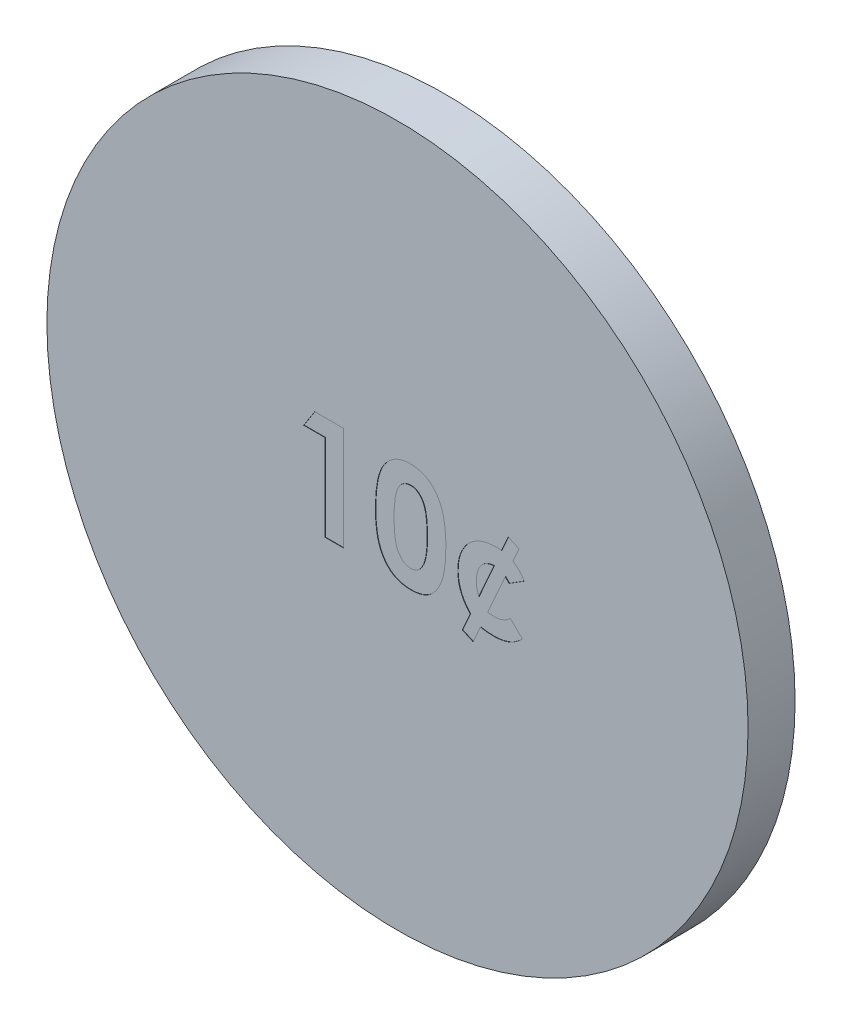
from build123d import *

# Parameters (mm, degrees)
SKETCH1_R           = 8.95
BOSS_EXTRUDE1_DEPTH = 1.2
CUT_EXTRUDE1_DEPTH  = 0.01


with BuildPart() as part:
    # Sketch1 → Boss-Extrude1 (new body)
    with BuildSketch(Plane.XY):
        Circle(SKETCH1_R)
    extrude(amount=BOSS_EXTRUDE1_DEPTH)

    # Sketch2 → Cut-Extrude1 (cut)
    # profile 1 of 3: a face of its own
    with BuildSketch(Plane.XY.offset(1.2)):
        Polygon((-2.111928597, 1.461526961), (-1.377858251, 1.461526961), (-1.377858251, -1.184306373), (-1.852751414, -1.184306373), (-1.852751414, 1.020554738), (-2.395486456, 1.020554738), align=None)
    # profile 2 of 3: a face of its own
    with BuildSketch(Plane.XY.offset(1.2)):
        with BuildLine():
            add(Edge.make_bspline(
                [(0.327199007, 1.529368841), (0.350185807, 1.529027595), (0.395383998, 1.528356616), (0.461952425, 1.521089357), (0.526076225, 1.510110556), (0.588006258, 1.494798957), (0.647296747, 1.474534601), (0.704379218, 1.450278514), (0.758574227, 1.420758415), (0.810572931, 1.387413947), (0.860355302, 1.349663282), (0.906724855, 1.306625575), (0.950528395, 1.259291125), (0.990817739, 1.20694432), (1.028485106, 1.15006131), (1.063406726, 1.088633075), (1.095315267, 1.022358966), (1.124568348, 0.951119384), (1.150726544, 0.87384648), (1.172759561, 0.789653899), (1.19165656, 0.698522416), (1.20760696, 0.600225189), (1.219662884, 0.494631559), (1.22778882, 0.381811676), (1.233365222, 0.261983041), (1.233820329, 0.179781582), (1.234054142, 0.137550265)],
                knots=[0, 0, 0, 0, 0.879237366, 1.728815576, 2.559023295, 3.367336655, 4.166867292, 4.954216142, 5.737608147, 6.525189134, 7.316157332, 8.124696809, 8.942788509, 9.781158001, 10.649253743, 11.551476218, 12.482711956, 13.461909668, 14.496590415, 15.601789533, 16.789733467, 18.056700938, 19.410929216, 20.8549011, 22.384193279, 24, 24, 24, 24], degree=3))
            add(Edge.make_bspline(
                [(1.234054142, 0.137550265), (1.233801453, 0.094790586), (1.233310484, 0.011709297), (1.228020633, -0.109215351), (1.218911259, -0.222854374), (1.207170442, -0.329196014), (1.191088733, -0.428184115), (1.172254817, -0.520074988), (1.149874016, -0.604835325), (1.122854176, -0.682274145), (1.093778166, -0.753638839), (1.061782341, -0.81978373), (1.027424385, -0.880887975), (0.991492366, -0.937873415), (0.952016357, -0.989060147), (0.910917769, -1.036188789), (0.866407094, -1.07746415), (0.820358405, -1.115013377), (0.771084751, -1.147463445), (0.719094279, -1.175843739), (0.663460089, -1.198863528), (0.605196297, -1.218884911), (0.543309786, -1.233258104), (0.478783924, -1.24466276), (0.410890226, -1.250965672), (0.364665462, -1.25174759), (0.340979389, -1.252148253)],
                knots=[0, 0, 0, 0, 1.643780988, 3.193836972, 4.651895693, 6.025988579, 7.305620092, 8.505800249, 9.631074763, 10.672816429, 11.65661981, 12.592235626, 13.49536222, 14.350718032, 15.179365177, 15.97804903, 16.751647189, 17.51006938, 18.259804725, 19.016521909, 19.783502495, 20.571750527, 21.382245291, 22.22305063, 23.089471752, 24, 24, 24, 24], degree=3))
            add(Edge.make_bspline(
                [(0.340979389, -1.252148253), (0.317293955, -1.251739861), (0.270894537, -1.250939828), (0.202817248, -1.244709624), (0.137949431, -1.233211903), (0.075573299, -1.218774564), (0.016122978, -1.198907827), (-0.040686592, -1.175199302), (-0.094418597, -1.146996087), (-0.14522181, -1.114470414), (-0.192922776, -1.07717242), (-0.238262768, -1.035501049), (-0.28114149, -0.989561926), (-0.320906651, -0.938840497), (-0.358209489, -0.884013785), (-0.392660995, -0.824455697), (-0.424240463, -0.760252948), (-0.453935707, -0.691316046), (-0.479737115, -0.616160858), (-0.50269917, -0.534116259), (-0.521509081, -0.444498338), (-0.536637271, -0.347335886), (-0.548715608, -0.242834747), (-0.557700503, -0.13094448), (-0.563019737, -0.01161297), (-0.563505558, 0.070409521), (-0.563755687, 0.112639574)],
                knots=[0, 0, 0, 0, 0.917216111, 1.796812873, 2.643793957, 3.46689424, 4.273913431, 5.068098542, 5.848489301, 6.620921603, 7.401012384, 8.190319798, 9.003608147, 9.831726257, 10.68377682, 11.569763213, 12.493818149, 13.453288342, 14.474581811, 15.568529029, 16.750744269, 18.018426408, 19.375425659, 20.823733699, 22.36466933, 24, 24, 24, 24], degree=3))
            add(Edge.make_bspline(
                [(-0.563755687, 0.112639574), (-0.563302601, 0.171314909), (-0.562428366, 0.284529722), (-0.551349415, 0.448092211), (-0.535088325, 0.599277399), (-0.511204635, 0.73783239), (-0.481672783, 0.864270351), (-0.443855709, 0.977758376), (-0.400803721, 1.079866827), (-0.364117896, 1.140356487), (-0.346449664, 1.169488866)],
                knots=[0, 0, 0, 0, 1.288568992, 2.486310467, 3.599230591, 4.627010532, 5.572937695, 6.447898582, 7.252493626, 8, 8, 8, 8], degree=3))
            add(Edge.make_bspline(
                [(-0.346449664, 1.169488866), (-0.325905886, 1.198108506), (-0.285738751, 1.254065542), (-0.215505392, 1.327526671), (-0.140048793, 1.390354225), (-0.057819117, 1.441126361), (0.029883139, 1.481165272), (0.123810943, 1.509444304), (0.223617436, 1.525920985), (0.292156219, 1.528202393), (0.327199007, 1.529368841)],
                knots=[0, 0, 0, 0, 1.058512271, 2.069600068, 3.047294572, 4.004278952, 4.967380941, 5.939006123, 6.946246673, 8, 8, 8, 8], degree=3))
        make_face()
        with BuildLine():
            add(Edge.make_bspline(
                [(0.33885933, 1.054475679), (0.318079072, 1.053490736), (0.277338736, 1.051559725), (0.218222567, 1.035168166), (0.16247971, 1.00985052), (0.120077608, 0.979384692), (0.088340057, 0.950179542), (0.066164802, 0.923749831), (0.044780263, 0.894256178), (0.025892362, 0.860367687), (0.008057253, 0.82330201), (-0.009373025, 0.782890893), (-0.023661275, 0.73814175), (-0.037699103, 0.689816665), (-0.049997549, 0.636579579), (-0.060300951, 0.577995336), (-0.069506136, 0.513682957), (-0.075926861, 0.443600319), (-0.081912905, 0.367820745), (-0.086203984, 0.286175427), (-0.087997976, 0.198686392), (-0.088568232, 0.138433991), (-0.088862525, 0.107339427)],
                knots=[0, 0, 0, 0, 1.076674018, 2.110852608, 3.161083442, 4.239746716, 4.804137807, 5.395870207, 6.026861976, 6.692161227, 7.405688833, 8.16177676, 8.973626916, 9.841385931, 10.773283133, 11.807421078, 12.927755683, 14.143907515, 15.458935494, 16.872852025, 18.386167141, 20, 20, 20, 20], degree=3))
            add(Edge.make_bspline(
                [(-0.088862525, 0.107339427), (-0.088378154, 0.067054916), (-0.087449338, -0.010193621), (-0.082584634, -0.121279706), (-0.072833739, -0.222376989), (-0.060705593, -0.314170643), (-0.043671118, -0.396065362), (-0.024071851, -0.468835945), (0.000131501, -0.531554744), (0.028103137, -0.585128814), (0.059082985, -0.630704164), (0.092712973, -0.669443417), (0.12784812, -0.702989783), (0.165585108, -0.730239082), (0.205833908, -0.751121689), (0.248258518, -0.76614229), (0.292885896, -0.775337025), (0.323446265, -0.77661204), (0.33885933, -0.777255091)],
                knots=[0, 0, 0, 0, 1.771748488, 3.397459088, 4.888034009, 6.237357457, 7.467047327, 8.564189669, 9.548206622, 10.417051504, 11.216568818, 11.965764335, 12.669334354, 13.348544111, 14.005342236, 14.656555988, 15.322436492, 16, 16, 16, 16], degree=3))
            add(Edge.make_bspline(
                [(0.33885933, -0.777255091), (0.353743468, -0.776815067), (0.382884759, -0.775953556), (0.425379289, -0.767110262), (0.465565135, -0.752732987), (0.503320965, -0.732395322), (0.538781826, -0.706532868), (0.571774407, -0.675031977), (0.602049884, -0.637578656), (0.619688515, -0.609782753), (0.628777366, -0.595460052)],
                knots=[0, 0, 0, 0, 0.992283464, 1.942767638, 2.88273346, 3.832339453, 4.79467288, 5.803907806, 6.868395428, 8, 8, 8, 8], degree=3))
            add(Edge.make_bspline(
                [(0.628777366, -0.595460052), (0.639477957, -0.575888539), (0.66191623, -0.534848664), (0.687881837, -0.465595406), (0.709738239, -0.387489176), (0.728549724, -0.300286901), (0.741415632, -0.203644644), (0.752495736, -0.098175223), (0.757839946, 0.016652465), (0.758709211, 0.096205501), (0.759160979, 0.137550265)],
                knots=[0, 0, 0, 0, 0.710965849, 1.490837728, 2.352621235, 3.297892224, 4.334225155, 5.461620853, 6.680770821, 8, 8, 8, 8], degree=3))
            add(Edge.make_bspline(
                [(0.759160979, 0.137550265), (0.758986471, 0.179253921), (0.758650572, 0.25952634), (0.752487801, 0.374766841), (0.743905672, 0.480019913), (0.731352494, 0.575050569), (0.715200549, 0.6600895), (0.695293216, 0.735131149), (0.671823951, 0.800323408), (0.6439922, 0.855601271), (0.613166806, 0.902579872), (0.580444709, 0.942883867), (0.545687548, 0.977294401), (0.508953446, 1.005940968), (0.469392182, 1.027829093), (0.427759425, 1.04328392), (0.383969827, 1.052633572), (0.354099122, 1.053853355), (0.33885933, 1.054475679)],
                knots=[0, 0, 0, 0, 1.793836731, 3.452829483, 4.963243077, 6.335886805, 7.574563692, 8.684454726, 9.672768357, 10.54971625, 11.340229787, 12.085688095, 12.778991901, 13.440269426, 14.083255152, 14.715733572, 15.344777694, 16, 16, 16, 16], degree=3))
        make_face(mode=Mode.SUBTRACT)
    # profile 3 of 3: a face of its own
    with BuildSketch(Plane.XY.offset(1.2)):
        with BuildLine():
            Line((2.827278301, 1.160478617), (3.103945969, 1.038575238))
            Line((3.103945969, 1.038575238), (2.950241709, 0.690885601))
            add(Edge.make_bspline(
                [(2.950241709, 0.690885601), (2.979931768, 0.669283056), (3.038248552, 0.626851651), (3.115079278, 0.553012195), (3.182056863, 0.47390359), (3.217705259, 0.415941065), (3.235389612, 0.387187184)],
                knots=[0, 0, 0, 0, 1.047918432, 2.058306149, 3.036770164, 4, 4, 4, 4], degree=3))
            Line((3.235389612, 0.387187184), (2.843178741, 0.142320397))
            add(Edge.make_bspline(
                [(2.843178741, 0.142320397), (2.829218663, 0.160296267), (2.800987963, 0.196647885), (2.768459404, 0.229212065), (2.752016215, 0.245673261)],
                knots=[0, 0, 0, 0, 0.988999762, 2, 2, 2, 2], degree=3))
            Line((2.752016215, 0.245673261), (2.304153801, -0.764004723))
            add(Edge.make_bspline(
                [(2.304153801, -0.764004723), (2.335914556, -0.767936102), (2.398401265, -0.775670769), (2.461353938, -0.776732846), (2.492309016, -0.777255091)],
                knots=[0, 0, 0, 0, 1.01656031, 2, 2, 2, 2], degree=3))
            add(Edge.make_bspline(
                [(2.492309016, -0.777255091), (2.510363823, -0.776774241), (2.546121161, -0.775821923), (2.59877202, -0.767350059), (2.650138339, -0.755031243), (2.699434739, -0.735976244), (2.747774327, -0.712665071), (2.794053354, -0.683351372), (2.839136349, -0.649337367), (2.866742975, -0.623126205), (2.880809784, -0.609770449)],
                knots=[0, 0, 0, 0, 0.996505377, 1.973567467, 2.939160258, 3.908787646, 4.886336879, 5.898955714, 6.929424149, 8, 8, 8, 8], degree=3))
            Line((2.880809784, -0.609770449), (3.188218305, -0.913998881))
            add(Edge.make_bspline(
                [(3.188218305, -0.913998881), (3.162974941, -0.939178952), (3.113536174, -0.98849376), (3.031344339, -1.050605526), (2.947790855, -1.104571628), (2.859600286, -1.146887566), (2.766703152, -1.178908763), (2.667929449, -1.201568347), (2.562845429, -1.215525271), (2.490586356, -1.217312798), (2.453617944, -1.218227313)],
                knots=[0, 0, 0, 0, 1.043298656, 2.043285471, 3.011024784, 3.953140877, 4.900813052, 5.883793724, 6.917329236, 8, 8, 8, 8], degree=3))
            add(Edge.make_bspline(
                [(2.453617944, -1.218227313), (2.425693604, -1.217801049), (2.369597296, -1.216944742), (2.285526183, -1.210559268), (2.201387402, -1.199241524), (2.145640699, -1.188953402), (2.11758863, -1.183776358)],
                knots=[0, 0, 0, 0, 0.990386989, 1.989556538, 2.988333023, 4, 4, 4, 4], degree=3))
            Line((2.11758863, -1.183776358), (1.932083489, -1.603017978))
            Line((1.932083489, -1.603017978), (1.655415821, -1.481114599))
            Line((1.655415821, -1.481114599), (1.856821403, -1.026361995))
            add(Edge.make_bspline(
                [(1.856821403, -1.026361995), (1.831515947, -0.998568352), (1.781401171, -0.943525987), (1.716904836, -0.853425402), (1.661673804, -0.759188932), (1.617258498, -0.660057853), (1.581836188, -0.556709087), (1.557186644, -0.44870333), (1.541830954, -0.336197233), (1.540181367, -0.259657639), (1.539342603, -0.220739666)],
                knots=[0, 0, 0, 0, 1.014667843, 2.009442197, 2.986811145, 3.960841764, 4.938839748, 5.933304939, 6.94915064, 8, 8, 8, 8], degree=3))
            add(Edge.make_bspline(
                [(1.539342603, -0.220739666), (1.539840936, -0.196528263), (1.540827836, -0.148579898), (1.545916182, -0.077751703), (1.555476779, -0.008871997), (1.56942923, 0.057566686), (1.586235836, 0.122312539), (1.607409774, 0.184625146), (1.632602506, 0.24488972), (1.660954106, 0.303133773), (1.69338423, 0.358508472), (1.728314809, 0.411287898), (1.766422139, 0.460524141), (1.807677771, 0.506400641), (1.851402201, 0.549504482), (1.899106833, 0.588696512), (1.949140442, 0.625351843), (2.002468144, 0.658167436), (2.057644485, 0.68765062), (2.114723602, 0.713502455), (2.173796293, 0.734297159), (2.23412822, 0.752673598), (2.296330862, 0.766419188), (2.360110342, 0.775777528), (2.425411997, 0.781813987), (2.469505152, 0.782673813), (2.491779002, 0.783108157)],
                knots=[0, 0, 0, 0, 1.122951297, 2.223897491, 3.291064162, 4.345161121, 5.370625362, 6.391464092, 7.394189996, 8.398187079, 9.393116873, 10.367973924, 11.331611019, 12.277388416, 13.227591561, 14.17592071, 15.137919351, 16.101939512, 17.076934275, 18.037780842, 19.004478214, 19.979163099, 20.961155522, 21.955342855, 22.96713253, 24, 24, 24, 24], degree=3))
            add(Edge.make_bspline(
                [(2.491779002, 0.783108157), (2.518279736, 0.783108157), (2.574284622, 0.783108157), (2.630289507, 0.783108157), (2.659793658, 0.783108157)],
                knots=[0, 0, 0, 0, 0.94637224, 2, 2, 2, 2], degree=3))
            Line((2.659793658, 0.783108157), (2.827278301, 1.160478617))
        make_face()
        with BuildLine():
            add(Edge.make_bspline(
                [(2.464218238, 0.342135935), (2.447228917, 0.340630933), (2.413944696, 0.337682446), (2.365336153, 0.328887713), (2.319713444, 0.314771129), (2.276521002, 0.297553955), (2.236382018, 0.275549218), (2.199291617, 0.249346394), (2.164289706, 0.219695232), (2.133290398, 0.184938563), (2.104949853, 0.146776793), (2.080758383, 0.104682784), (2.059586931, 0.059285209), (2.043742604, 0.009787902), (2.030244259, -0.042891336), (2.020711694, -0.099246471), (2.015664978, -0.159341847), (2.014721096, -0.200590316), (2.014235766, -0.221799695)],
                knots=[0, 0, 0, 0, 1.01172888, 1.98210437, 2.923863815, 3.840675468, 4.736636748, 5.632291391, 6.531618773, 7.451779958, 8.38891961, 9.3471603, 10.327449333, 11.355018587, 12.425325346, 13.552336786, 14.741446174, 16, 16, 16, 16], degree=3))
            add(Edge.make_bspline(
                [(2.014235766, -0.221799695), (2.014873412, -0.249231566), (2.016134102, -0.303467098), (2.028455116, -0.383283704), (2.047028986, -0.460697762), (2.065816877, -0.509945665), (2.075187455, -0.534508363)],
                knots=[0, 0, 0, 0, 1.026133772, 2.028768308, 3.01683595, 4, 4, 4, 4], degree=3))
            Line((2.075187455, -0.534508363), (2.464218238, 0.342135935))
        make_face(mode=Mode.SUBTRACT)
    extrude(amount=-CUT_EXTRUDE1_DEPTH, mode=Mode.SUBTRACT)


solid = part.part
